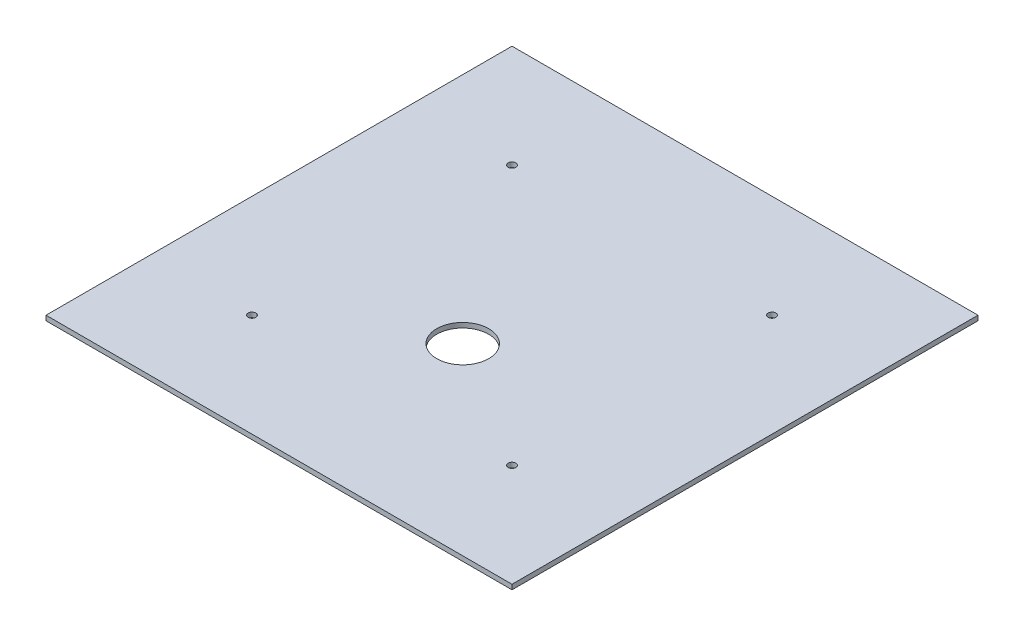
from build123d import *

# Parameters (mm, degrees)
SKETCH2_W           = 304.8
SKETCH2_H           = 304.8
BOSS_EXTRUDE1_DEPTH = 3.175
SKETCH3_R           = 2.5
CUT_EXTRUDE1_DEPTH  = 216.549531721
SKETCH4_R           = 17
CUT_EXTRUDE2_DEPTH  = 216.549531721


with BuildPart() as part:
    # Sketch2 → Boss-Extrude1 (new body)
    with BuildSketch(Plane(origin=(0, 0, 0), x_dir=(1, 0, 0), z_dir=(0, 1, 0))):
        Rectangle(SKETCH2_W, SKETCH2_H)
    extrude(amount=BOSS_EXTRUDE1_DEPTH)

    # Sketch3 → Cut-Extrude1 (cut, through all)
    with BuildSketch(Plane(origin=(0, 3.175, 0), x_dir=(1, 0, 0), z_dir=(0, 1, 0))):
        with Locations(Location((-85.035, 85.035, 0), (0, 0, 270))):
            Circle(SKETCH3_R)
        with Locations(Location((85.035, 85.035, 0), (0, 0, 270))):
            Circle(SKETCH3_R)
        with Locations(Location((-85.035, -85.035, 0), (0, 0, 270))):
            Circle(SKETCH3_R)
        with Locations(Location((85.035, -85.035, 0), (0, 0, 270))):
            Circle(SKETCH3_R)
    extrude(amount=-CUT_EXTRUDE1_DEPTH, mode=Mode.SUBTRACT)

    # Sketch4 → Cut-Extrude2 (cut, through all)
    with BuildSketch(Plane(origin=(0, 3.175, 0), x_dir=(1, 0, 0), z_dir=(0, 1, 0))):
        with Locations(Location((0, -32.24, 0), (0, 0, 270))):
            Circle(SKETCH4_R)
    extrude(amount=-CUT_EXTRUDE2_DEPTH, mode=Mode.SUBTRACT)


solid = part.part
